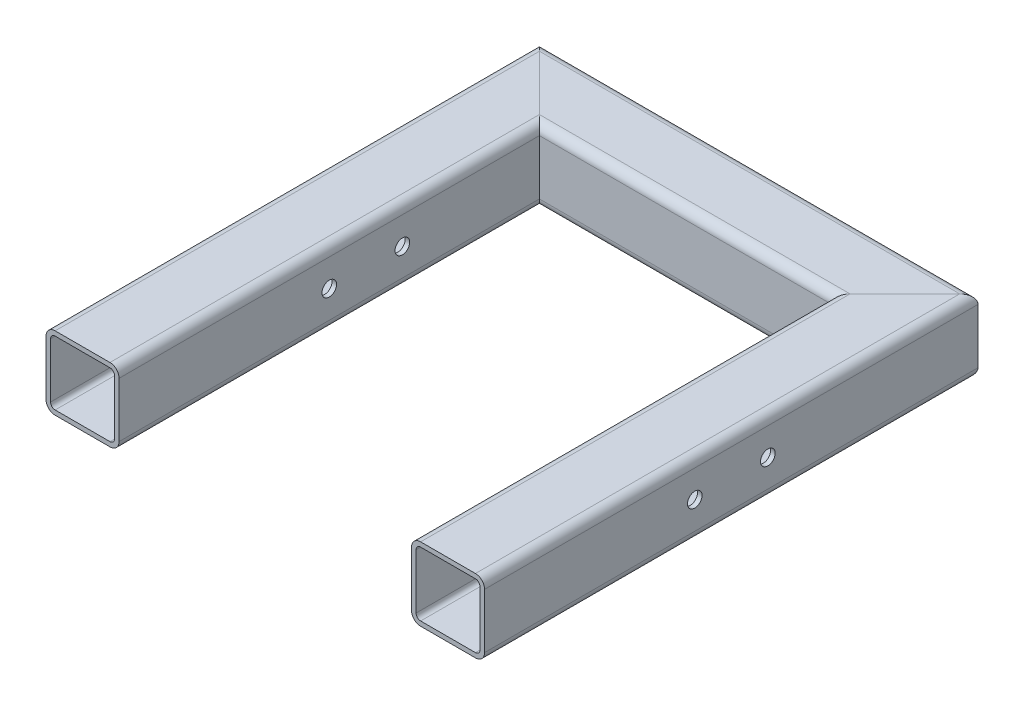
from build123d import *

# Parameters (mm, degrees)
SQUARE_TUBE_80_X_80_X_5_1_DEPTH   = 557.568542495
SQUARE_TUBE_80_X_80_X_5_1_2_DEPTH = 515.13708499
SQUARE_TUBE_80_X_80_X_5_1_3_DEPTH = 557.568542495
CUT_EXTRUDE1_START                = -480
SKETCH2_R                         = 8
CUT_EXTRUDE1_DEPTH                = 480


with BuildPart() as part:
    # Sketch1 → Square tube 80 X 80 X 5(1) (new body)
    with BuildSketch(Plane(origin=(0, 0, 0), x_dir=(1, 0, 0), z_dir=(0, 0, -1))):
        with BuildLine():
            Line((-30, -40), (30, -40))
            ThreePointArc((30, -40), (37.071067812, -37.071067812), (40, -30))
            Line((40, -30), (40, 30))
            ThreePointArc((40, 30), (37.071067812, 37.071067812), (30, 40))
            Line((30, 40), (-30, 40))
            ThreePointArc((-30, 40), (-37.071067812, 37.071067812), (-40, 30))
            Line((-40, 30), (-40, -30))
            ThreePointArc((-40, -30), (-37.071067812, -37.071067812), (-30, -40))
        make_face()
        with BuildLine():
            Line((-30, -35), (30, -35))
            ThreePointArc((30, -35), (33.535533906, -33.535533906), (35, -30))
            Line((35, -30), (35, 30))
            ThreePointArc((35, 30), (33.535533906, 33.535533906), (30, 35))
            Line((30, 35), (-30, 35))
            ThreePointArc((-30, 35), (-33.535533906, 33.535533906), (-35, 30))
            Line((-35, 30), (-35, -30))
            ThreePointArc((-35, -30), (-33.535533906, -33.535533906), (-30, -35))
        make_face(mode=Mode.SUBTRACT)
    extrude(amount=SQUARE_TUBE_80_X_80_X_5_1_DEPTH)

    # Square tube 80 X 80 X 5(1) mitre 1
    split(bisect_by=Plane(origin=(0, 0, -500), x_dir=(0, -1, 0), z_dir=(-0.707106781, 0, 0.707106781)), keep=Keep.TOP)


with BuildPart() as body_2:
    # Sketch1 on segment 2 (carried to segment 2) → Square tube 80 X 80 X 5_1 2 (new body)
    with BuildSketch(Plane(origin=(-57.568542495, 0, -500), x_dir=(0, 0, 1), z_dir=(1, 0, 0))):
        with BuildLine():
            Line((-30, -40), (30, -40))
            ThreePointArc((30, -40), (37.071067812, -37.071067812), (40, -30))
            Line((40, -30), (40, 30))
            ThreePointArc((40, 30), (37.071067812, 37.071067812), (30, 40))
            Line((30, 40), (-30, 40))
            ThreePointArc((-30, 40), (-37.071067812, 37.071067812), (-40, 30))
            Line((-40, 30), (-40, -30))
            ThreePointArc((-40, -30), (-37.071067812, -37.071067812), (-30, -40))
        make_face()
        with BuildLine():
            Line((-30, -35), (30, -35))
            ThreePointArc((30, -35), (33.535533906, -33.535533906), (35, -30))
            Line((35, -30), (35, 30))
            ThreePointArc((35, 30), (33.535533906, 33.535533906), (30, 35))
            Line((30, 35), (-30, 35))
            ThreePointArc((-30, 35), (-33.535533906, 33.535533906), (-35, 30))
            Line((-35, 30), (-35, -30))
            ThreePointArc((-35, -30), (-33.535533906, -33.535533906), (-30, -35))
        make_face(mode=Mode.SUBTRACT)
    extrude(amount=SQUARE_TUBE_80_X_80_X_5_1_2_DEPTH)

    # Square tube 80 X 80 X 5_1 2 mitre 1
    split(bisect_by=Plane(origin=(0, 0, -500), x_dir=(0, 1, 0), z_dir=(0.707106781, 0, -0.707106781)), keep=Keep.TOP)

    # Square tube 80 X 80 X 5_1 2 mitre 2
    split(bisect_by=Plane(origin=(400, 0, -500), x_dir=(0, -1, 0), z_dir=(-0.707106781, 0, -0.707106781)), keep=Keep.TOP)


with BuildPart() as body_3:
    # Sketch1 on segment 3 (carried to segment 3) → Square tube 80 X 80 X 5_1 3 (new body)
    with BuildSketch(Plane(origin=(400, 0, -557.568542495), x_dir=(-1, 0, 0), z_dir=(0, 0, 1))):
        with BuildLine():
            Line((-30, -40), (30, -40))
            ThreePointArc((30, -40), (37.071067812, -37.071067812), (40, -30))
            Line((40, -30), (40, 30))
            ThreePointArc((40, 30), (37.071067812, 37.071067812), (30, 40))
            Line((30, 40), (-30, 40))
            ThreePointArc((-30, 40), (-37.071067812, 37.071067812), (-40, 30))
            Line((-40, 30), (-40, -30))
            ThreePointArc((-40, -30), (-37.071067812, -37.071067812), (-30, -40))
        make_face()
        with BuildLine():
            Line((-30, -35), (30, -35))
            ThreePointArc((30, -35), (33.535533906, -33.535533906), (35, -30))
            Line((35, -30), (35, 30))
            ThreePointArc((35, 30), (33.535533906, 33.535533906), (30, 35))
            Line((30, 35), (-30, 35))
            ThreePointArc((-30, 35), (-33.535533906, 33.535533906), (-35, 30))
            Line((-35, 30), (-35, -30))
            ThreePointArc((-35, -30), (-33.535533906, -33.535533906), (-30, -35))
        make_face(mode=Mode.SUBTRACT)
    extrude(amount=SQUARE_TUBE_80_X_80_X_5_1_3_DEPTH)

    # Square tube 80 X 80 X 5_1 3 mitre 1
    split(bisect_by=Plane(origin=(400, 0, -500), x_dir=(0, 1, 0), z_dir=(0.707106781, 0, 0.707106781)), keep=Keep.TOP)


with BuildPart() as cut_extrude1_tool:
    # Sketch2 → Cut-Extrude1 (new body)
    with BuildSketch(Plane(origin=(440, 0, 0), x_dir=(0, 0, -1), z_dir=(1, 0, 0)).offset(CUT_EXTRUDE1_START)):
        with Locations(Location((230, 0, 0), (0, 0, 180))):
            Circle(SKETCH2_R)
        with Locations(Location((310, 0, 0), (0, 0, 180))):
            Circle(SKETCH2_R)
    extrude(amount=CUT_EXTRUDE1_DEPTH)


with BuildPart() as part_1:
    add(part.part)

    # Cut-Extrude1: cut by cut_extrude1_tool
    add(cut_extrude1_tool.part, mode=Mode.SUBTRACT)


with BuildPart() as body_3_1:
    add(body_3.part)

    # Cut-Extrude1: cut by cut_extrude1_tool
    add(cut_extrude1_tool.part, mode=Mode.SUBTRACT)


solid = Compound([body_2.part, part_1.part, body_3_1.part])
